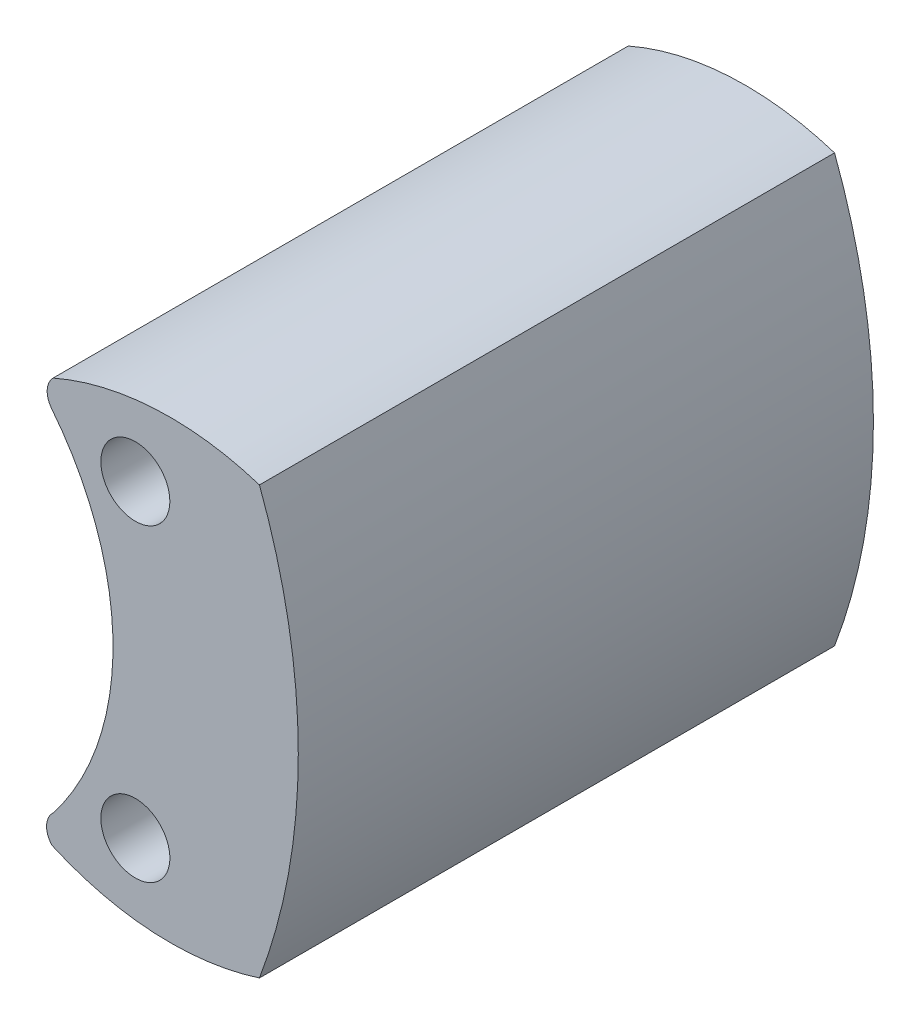
from build123d import *

# Parameters (mm, degrees)
EXTRUDE1_DEPTH      = 25
EXTRUDE1_DEPTH_BACK = 0.001
SKETCH3_R           = 1.5
CUT_EXTRUDE1_DEPTH  = 28.804066937
SKETCH5_R           = 4.335
CUT_EXTRUDE2_DEPTH  = 24


with BuildPart() as part:
    # Sketch1 → Extrude1 (new, two sides: drawn at the far end of the back side and taken through both)
    with BuildSketch(Plane.XY.offset(-EXTRUDE1_DEPTH_BACK)):
        with BuildLine():
            ThreePointArc((5.394294709, 9.281673418), (7.083207262, 0), (5.394294709, -9.281673418))
            ThreePointArc((5.394294709, -9.281673418), (0.839593343, -9.873480825), (-3.625620963, -8.797654747))
            ThreePointArc((-3.625620963, -8.797654747), (-3.857898862, -8.166383103), (-3.57576768, -7.555761366))
            ThreePointArc((-3.57576768, -7.555761366), (-0.970954643, 0.05080099), (-3.638712866, 7.635516404))
            ThreePointArc((-3.638712866, 7.635516404), (-3.831936153, 8.239573474), (-3.57576768, 8.819744049))
            ThreePointArc((-3.57576768, 8.819744049), (0.866819678, 9.874912356), (5.394294709, 9.281673418))
        make_face()
    extrude(amount=EXTRUDE1_DEPTH + EXTRUDE1_DEPTH_BACK)

    # Sketch3 → Cut-Extrude1 (cut, through all)
    with BuildSketch(Plane.XY.offset(25)):
        with Locations((0, 6.715)):
            Circle(SKETCH3_R)
        with Locations(Location((0, -6.715, 0), (0, 0, 180))):
            Circle(SKETCH3_R)
    extrude(amount=-CUT_EXTRUDE1_DEPTH, mode=Mode.SUBTRACT)

    # Sketch5 → Cut-Extrude2 (cut)
    with BuildSketch(Plane(origin=(0, 0, -0.001), x_dir=(-1, 0, 0), z_dir=(0, 0, -1))):
        Circle(SKETCH5_R)
    extrude(amount=-CUT_EXTRUDE2_DEPTH, mode=Mode.SUBTRACT)


solid = part.part
